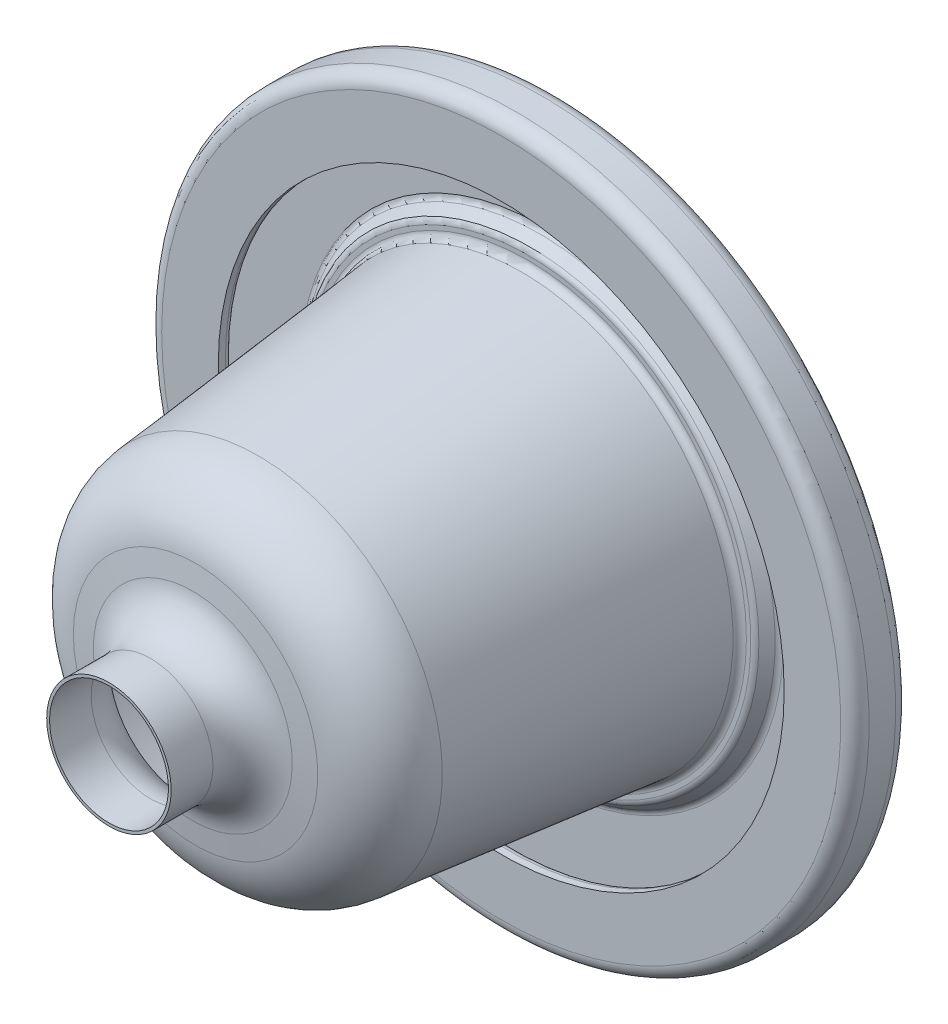
from build123d import *


with BuildPart() as part:
    # Sketch1 → Revolve1 (revolve)
    with BuildSketch(Plane(origin=(0, 0, 0), x_dir=(1, 0, 0), z_dir=(0, 1, 0)), mode=Mode.PRIVATE) as revolve1_sk:
        with BuildLine():
            Line((0, 2.405686837), (0, 2.605686837))
            Line((0, 2.605686837), (15.8, 2.605686837))
            ThreePointArc((15.8, 2.605686837), (15.941421356, 2.547108193), (16, 2.405686837))
            Line((16, 2.405686837), (16, 1.805686837))
            ThreePointArc((16, 1.805686837), (16.058578644, 1.66426548), (16.2, 1.605686837))
            Line((16.2, 1.605686837), (24, 1.605686837))
            ThreePointArc((24, 1.605686837), (24.707106781, 1.312793618), (25, 0.605686837))
            Line((25, 0.605686837), (25, -1.273236641))
            ThreePointArc((25, -1.273236641), (24.707106781, -1.980343422), (24, -2.273236641))
            Line((24, -2.273236641), (20, -2.273236641))
            Line((20, -2.273236641), (20, -1.773236641))
            ThreePointArc((20, -1.773236641), (20.146446609, -1.41968325), (20.5, -1.273236641))
            Line((20.5, -1.273236641), (23.5, -1.273236641))
            ThreePointArc((23.5, -1.273236641), (23.853553391, -1.126790031), (24, -0.773236641))
            Line((24, -0.773236641), (24, -0.394313163))
            ThreePointArc((24, -0.394313163), (23.707106781, 0.312793618), (23, 0.605686837))
            Line((23, 0.605686837), (17.052757994, 0.605686837))
            ThreePointArc((17.052757994, 0.605686837), (16.838250605, 0.557335572), (16.665230031, 0.421633158))
            Line((16.665230031, 0.421633158), (16.150056482, -0.210259485))
            ThreePointArc((16.150056482, -0.210259485), (15.977035907, -0.345961899), (15.762528519, -0.394313163))
            Line((15.762528519, -0.394313163), (15.450244603, -0.394313163))
            ThreePointArc((15.450244603, -0.394313163), (15.115661825, -0.522756486), (14.952978742, -0.842095704))
            Line((14.952978742, -0.842095704), (13, -19.440274835))
            ThreePointArc((13, -19.440274835), (11.594524486, -22.42169907), (8.638857943, -23.880564099))
            Line((8.638857943, -23.880564099), (7.033090066, -24.07844033))
            ThreePointArc((7.033090066, -24.07844033), (5.152698307, -25.068549754), (4.4, -27.055918642))
            Line((4.4, -27.055918642), (4.4, -30))
            Line((4.4, -30), (4.2, -30))
            Line((4.2, -30), (4.2, -27.055918642))
            ThreePointArc((4.2, -27.055918642), (5.002878194, -24.936058495), (7.008629403, -23.879941776))
            Line((7.008629403, -23.879941776), (8.61439728, -23.682065545))
            ThreePointArc((8.61439728, -23.682065545), (11.451837162, -22.281555117), (12.801093655, -19.419387852))
            Line((12.801093655, -19.419387852), (14.7728809, -0.642095704))
            ThreePointArc((14.7728809, -0.642095704), (14.935563984, -0.322756486), (15.270146762, -0.194313163))
            Line((15.270146762, -0.194313163), (15.667539926, -0.194313163))
            ThreePointArc((15.667539926, -0.194313163), (15.882047315, -0.145961899), (16.055067889, -0.010259485))
            Line((16.055067889, -0.010259485), (16.570241439, 0.621633158))
            ThreePointArc((16.570241439, 0.621633158), (16.743262013, 0.757335572), (16.957769401, 0.805686837))
            Line((16.957769401, 0.805686837), (23.2, 0.805686837))
            ThreePointArc((23.2, 0.805686837), (23.907106781, 0.512793618), (24.2, -0.194313163))
            Line((24.2, -0.194313163), (24.2, -0.973236641))
            ThreePointArc((24.2, -0.973236641), (24.053553391, -1.326790031), (23.7, -1.473236641))
            Line((23.7, -1.473236641), (20.7, -1.473236641))
            ThreePointArc((20.7, -1.473236641), (20.346446609, -1.61968325), (20.2, -1.973236641))
            Line((20.2, -1.973236641), (20.2, -2.073236641))
            Line((20.2, -2.073236641), (23.8, -2.073236641))
            ThreePointArc((23.8, -2.073236641), (24.507106781, -1.780343422), (24.8, -1.073236641))
            Line((24.8, -1.073236641), (24.8, 0.405686837))
            ThreePointArc((24.8, 0.405686837), (24.507106781, 1.112793618), (23.8, 1.405686837))
            Line((23.8, 1.405686837), (16, 1.405686837))
            ThreePointArc((16, 1.405686837), (15.858578644, 1.46426548), (15.8, 1.605686837))
            Line((15.8, 1.605686837), (15.8, 2.205686837))
            ThreePointArc((15.8, 2.205686837), (15.741421356, 2.347108193), (15.6, 2.405686837))
            Line((15.6, 2.405686837), (0.2, 2.405686837))
            Line((0.2, 2.405686837), (0, 2.405686837))
        make_face()
    revolve(revolve1_sk.sketch.rotate(Axis((0, 0, 0), (0, 0, 1)), 180), axis=Axis((0, 0, 0), (0, 0, 1)))


solid = part.part
